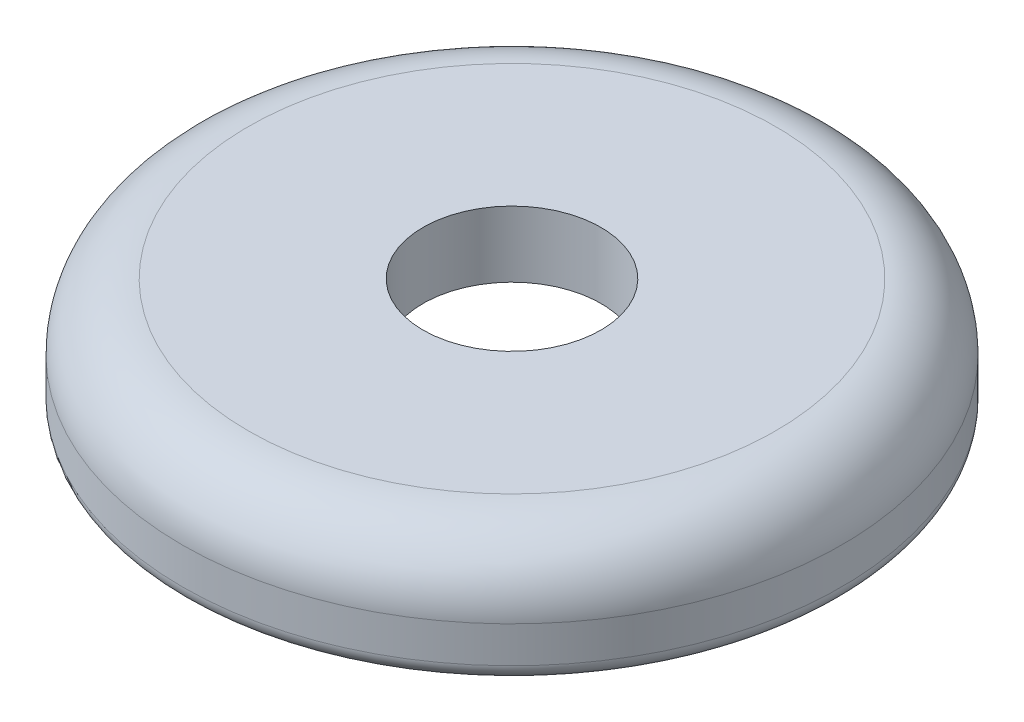
from build123d import *

# Parameters (mm, degrees)
SKETCH1_R           = 12.7
BOSS_EXTRUDE1_DEPTH = 2.032
SKETCH2_R           = 12.7
SKETCH2_R_2         = 3.429
BOSS_EXTRUDE2_DEPTH = 2.54
FILLET1_R           = 2.54
FILLET2_R           = 0.635


with BuildPart() as part:
    # Sketch1 → Boss-Extrude1 (new body)
    with BuildSketch(Plane(origin=(0, 0, 0), x_dir=(1, 0, 0), z_dir=(0, 1, 0))):
        with Locations(Location((0, 0, 0), (0, 0, 270))):
            Circle(SKETCH1_R)
        Polygon((7.478995387, 0), (3.739497694, 6.477), (-3.739497694, 6.477), (-7.478995387, 0), (-3.739497694, -6.477), (3.739497694, -6.477), align=None, mode=Mode.SUBTRACT)
    extrude(amount=BOSS_EXTRUDE1_DEPTH)

    # Sketch2 → Boss-Extrude2 (add)
    with BuildSketch(Plane(origin=(0, 2.032, 0), x_dir=(1, 0, 0), z_dir=(0, 1, 0))):
        with Locations(Location((0, 0, 0), (0, 0, 270))):
            Circle(SKETCH2_R)
        with Locations(Location((0, 0, 0), (0, 0, 270))):
            Circle(SKETCH2_R_2, mode=Mode.SUBTRACT)
    extrude(amount=BOSS_EXTRUDE2_DEPTH)

    # Fillet1
    fillet1_edges = [part.edges().sort_by_distance(p)[0] for p in [
        (0, 4.572, -12.7),
    ]]
    fillet(fillet1_edges, radius=FILLET1_R)

    # Fillet2
    fillet2_edges = [part.edges().sort_by_distance(p)[0] for p in [
        (0, 0, -6.477),
        (-5.60924654, 0, -3.2385),
        (-5.60924654, 0, 3.2385),
        (0, 0, 6.477),
        (0, 0, -12.7),
        (5.60924654, 0, 3.2385),
        (5.60924654, 0, -3.2385),
    ]]
    fillet(fillet2_edges, radius=FILLET2_R)


solid = part.part
